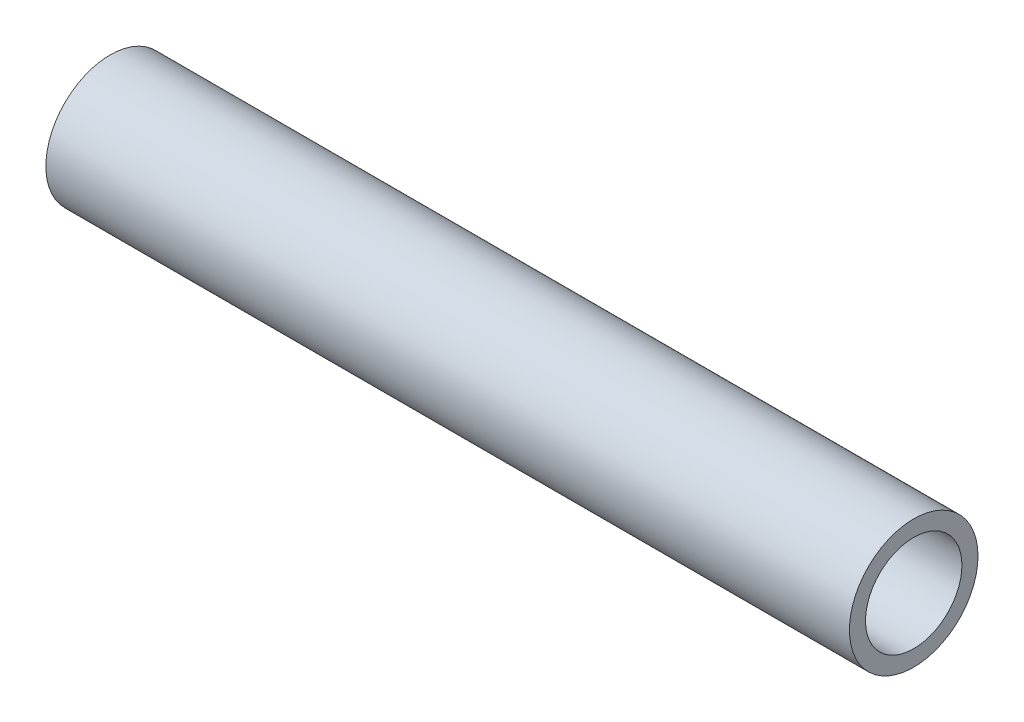
from build123d import *

# Parameters (mm, degrees)
SKETCH1_R               = 4
BOSS_EXTRUDE1_DEPTH     = 50
CUT_EXTRUDE1_DEPTH      = 51.318982502
CUT_EXTRUDE1_DEPTH_BACK = 51.318982502
SKETCH2_R               = 3


with BuildPart() as part:
    # Sketch1 → Boss-Extrude1 (new body)
    with BuildSketch(Plane(origin=(0, 0, 0), x_dir=(0, 0, -1), z_dir=(1, 0, 0))):
        Circle(SKETCH1_R)
    extrude(amount=BOSS_EXTRUDE1_DEPTH)

    # Sketch2 → Cut-Extrude1 (cut, two sides: drawn at the far end of the back side and taken through both)
    with BuildSketch(Plane(origin=(50, 0, 0), x_dir=(0, 0, -1), z_dir=(1, 0, 0)).offset(-CUT_EXTRUDE1_DEPTH_BACK)):
        Circle(SKETCH2_R)
    extrude(amount=CUT_EXTRUDE1_DEPTH + CUT_EXTRUDE1_DEPTH_BACK, mode=Mode.SUBTRACT)


solid = part.part
